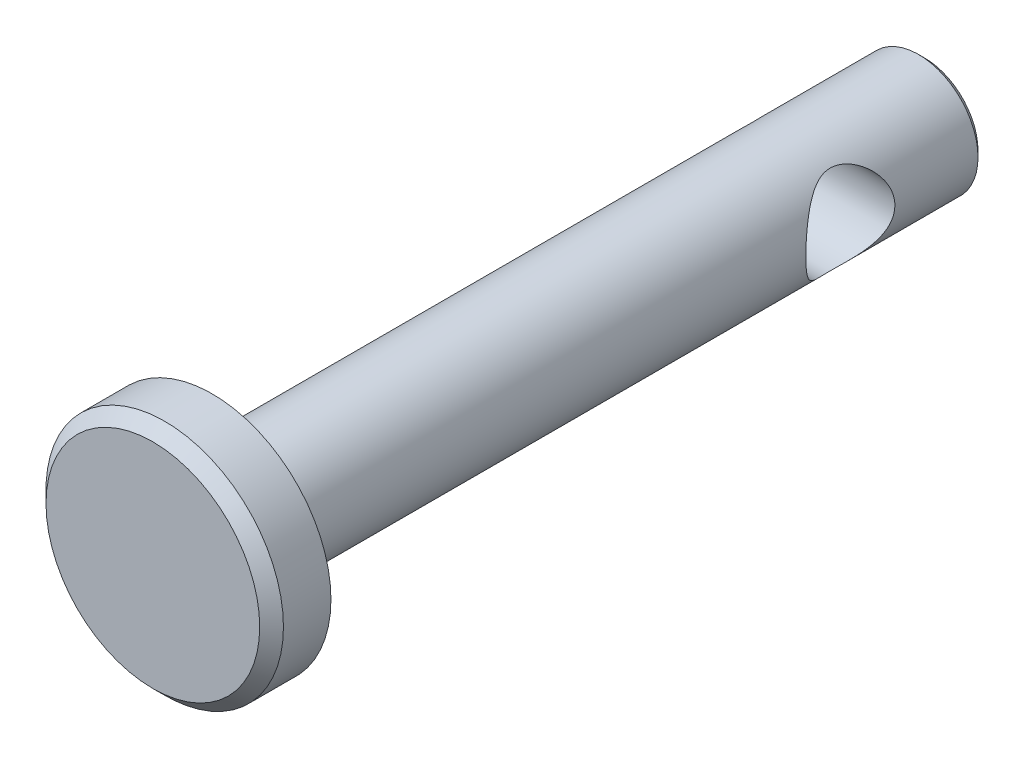
from build123d import *

# Parameters (mm, degrees)
SKETCH1_R           = 1.5875
EXTRUDE1_DEPTH      = 9.525
SKETCH2_R           = 3.175
EXTRUDE2_DEPTH      = 1.5875
CHAMFER1_SIZE       = 0.3175
EXTRUDE3_DEPTH      = 12.985362166
EXTRUDE3_DEPTH_BACK = 12.985362166
SKETCH3_R           = 1.190625
CHAMFER2_SIZE       = 0.15875


with BuildPart() as part:
    # Sketch1 → Extrude1 (new, symmetric)
    with BuildSketch(Plane.XY):
        with Locations(Location((0, 0, 0), (0, 0, 180))):
            Circle(SKETCH1_R)
    extrude(amount=EXTRUDE1_DEPTH, both=True)

    # Sketch2 → Extrude2 (add)
    with BuildSketch(Plane.XY.offset(9.525)):
        Circle(SKETCH2_R)
    extrude(amount=EXTRUDE2_DEPTH)

    # Chamfer1
    chamfer1_edges = [part.edges().sort_by_distance(p)[0] for p in [
        (-3.175, 0, 11.1125),
    ]]
    chamfer(chamfer1_edges, length=CHAMFER1_SIZE)

    # Sketch3 → Extrude3 (cut, two sides: drawn at the far end of the back side and taken through both)
    with BuildSketch(Plane(origin=(0, 0, 0), x_dir=(0, 0, -1), z_dir=(1, 0, 0)).offset(-EXTRUDE3_DEPTH_BACK)):
        with Locations(Location((5.953125, 0, 0), (0, 0, 180))):
            Circle(SKETCH3_R)
    extrude(amount=EXTRUDE3_DEPTH + EXTRUDE3_DEPTH_BACK, mode=Mode.SUBTRACT)

    # Chamfer2
    chamfer2_edges = [part.edges().sort_by_distance(p)[0] for p in [
        (1.5875, 0, -9.525),
    ]]
    chamfer(chamfer2_edges, length=CHAMFER2_SIZE)


solid = part.part
